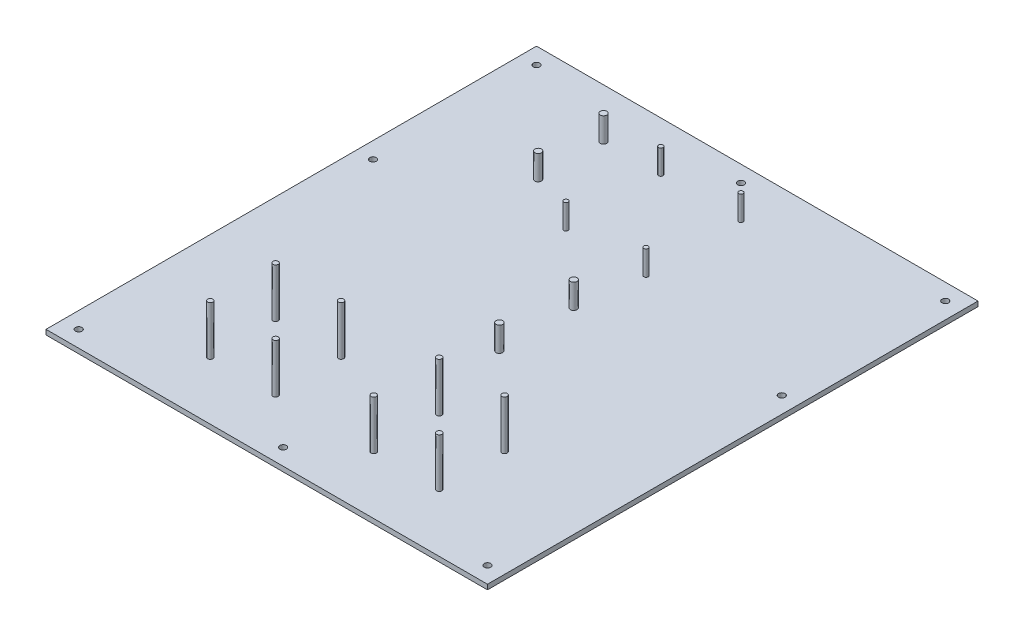
from build123d import *

# Parameters (mm, degrees)
SKETCH1_W            = 270
SKETCH1_H            = 300
SKETCH1_R            = 2
BOSS_EXTRUDE1_DEPTH  = 3
SKETCH2_R            = 1.35
BOSS_EXTRUDE2_DEPTH  = 10
SKETCH3_R            = 2
BOSS_EXTRUDE3_DEPTH  = 15
SKETCH4_R            = 1.35
BOSS_EXTRUDE4_DEPTH  = 5
SKETCH5_R            = 2
BOSS_EXTRUDE5_DEPTH  = 15
SKETCH6_R            = 1.6
BOSS_EXTRUDE6_DEPTH  = 15
SKETCH7_R            = 2
BOSS_EXTRUDE7_DEPTH  = 15
CUT_EXTRUDE1_START   = -15
SKETCH8_R            = 1.6
CUT_EXTRUDE1_DEPTH   = 15
SKETCH9_R            = 1.6
BOSS_EXTRUDE8_DEPTH  = 15
CUT_EXTRUDE3_START   = -15
SKETCH10_R           = 1.6
CUT_EXTRUDE3_DEPTH   = 15
SKETCH11_R           = 1.6
BOSS_EXTRUDE9_DEPTH  = 15
SKETCH12_R           = 1.6
BOSS_EXTRUDE10_DEPTH = 15
CUT_EXTRUDE4_START   = -15
SKETCH13_R           = 2
CUT_EXTRUDE4_DEPTH   = 15
SKETCH14_R           = 1.35
BOSS_EXTRUDE11_DEPTH = 15
CUT_EXTRUDE7_START   = -15
SKETCH15_R           = 1.35
CUT_EXTRUDE7_DEPTH   = 15
SKETCH16_R           = 1.35
BOSS_EXTRUDE12_DEPTH = 15
SKETCH18_R           = 1.35
CUT_EXTRUDE9_DEPTH   = 15


with BuildPart() as part:
    # Sketch1 → Boss-Extrude1 (new body)
    with BuildSketch(Plane(origin=(0, 0, 0), x_dir=(1, 0, 0), z_dir=(0, 1, 0))):
        with Locations((135, 150)):
            Rectangle(SKETCH1_W, SKETCH1_H)
        with Locations(Location((10, 290, 0), (0, 0, 270))):
            Circle(SKETCH1_R, mode=Mode.SUBTRACT)
        with Locations(Location((10, 190, 0), (0, 0, 270))):
            Circle(SKETCH1_R, mode=Mode.SUBTRACT)
        with Locations(Location((10, 10, 0), (0, 0, 270))):
            Circle(SKETCH1_R, mode=Mode.SUBTRACT)
        with Locations(Location((135, 10, 0), (0, 0, 270))):
            Circle(SKETCH1_R, mode=Mode.SUBTRACT)
        with Locations(Location((260, 290, 0), (0, 0, 90))):
            Circle(SKETCH1_R, mode=Mode.SUBTRACT)
        with Locations(Location((260, 190, 0), (0, 0, 90))):
            Circle(SKETCH1_R, mode=Mode.SUBTRACT)
        with Locations(Location((260, 10, 0), (0, 0, 90))):
            Circle(SKETCH1_R, mode=Mode.SUBTRACT)
        with Locations(Location((135, 290, 0), (0, 0, 270))):
            Circle(SKETCH1_R, mode=Mode.SUBTRACT)
    extrude(amount=BOSS_EXTRUDE1_DEPTH)

    # Sketch2 → Boss-Extrude2 (add)
    with BuildSketch(Plane(origin=(0, 3, 0), x_dir=(1, 0, 0), z_dir=(0, 1, 0))):
        with Locations(Location((106, 270, 0), (0, 0, 90))):
            Circle(SKETCH2_R)
        with Locations(Location((155, 270, 0), (0, 0, 90))):
            Circle(SKETCH2_R)
        with Locations(Location((106, 212, 0), (0, 0, 90))):
            Circle(SKETCH2_R)
        with Locations(Location((155, 212, 0), (0, 0, 90))):
            Circle(SKETCH2_R)
    extrude(amount=BOSS_EXTRUDE2_DEPTH)

    # Sketch3 → Boss-Extrude3 (add)
    with BuildSketch(Plane(origin=(0, 3, 0), x_dir=(1, 0, 0), z_dir=(0, 1, 0))):
        with Locations(Location((150, 172.75, 0), (0, 0, 90))):
            Circle(SKETCH3_R)
        with Locations(Location((150, 127.25, 0), (0, 0, 90))):
            Circle(SKETCH3_R)
    extrude(amount=BOSS_EXTRUDE3_DEPTH)

    # Sketch4 → Boss-Extrude4 (add)
    with BuildSketch(Plane(origin=(0, 13, 0), x_dir=(1, 0, 0), z_dir=(0, 1, 0))):
        with Locations(Location((106, 212, 0), (0, 0, 90))):
            Circle(SKETCH4_R)
        with Locations(Location((155, 212, 0), (0, 0, 90))):
            Circle(SKETCH4_R)
        with Locations(Location((155, 270, 0), (0, 0, 90))):
            Circle(SKETCH4_R)
        with Locations(Location((106, 270, 0), (0, 0, 90))):
            Circle(SKETCH4_R)
    extrude(amount=BOSS_EXTRUDE4_DEPTH)

    # Sketch5 → Boss-Extrude5 (add)
    with BuildSketch(Plane(origin=(0, 3, 0), x_dir=(1, 0, 0), z_dir=(0, 1, 0))):
        with Locations(Location((41, 270, 0), (0, 0, 90))):
            Circle(SKETCH5_R)
        with Locations(Location((71, 270, 0), (0, 0, 90))):
            Circle(SKETCH5_R)
    extrude(amount=BOSS_EXTRUDE5_DEPTH)

    # Sketch6 → Boss-Extrude6 (add)
    with BuildSketch(Plane(origin=(0, 3, 0), x_dir=(1, 0, 0), z_dir=(0, 1, 0))):
        with Locations(Location((65, 75.462075724, 0), (0, 0, 90))):
            Circle(SKETCH6_R)
        with Locations(Location((105, 75.462075724, 0), (0, 0, 90))):
            Circle(SKETCH6_R)
        with Locations(Location((65, 35.462075724, 0), (0, 0, 90))):
            Circle(SKETCH6_R)
        with Locations(Location((105, 35.462075724, 0), (0, 0, 90))):
            Circle(SKETCH6_R)
        with Locations(Location((165, 35.462075724, 0), (0, 0, 90))):
            Circle(SKETCH6_R)
        with Locations(Location((205, 35.462075724, 0), (0, 0, 90))):
            Circle(SKETCH6_R)
        with Locations(Location((205, 75.462075724, 0), (0, 0, 90))):
            Circle(SKETCH6_R)
        with Locations(Location((165, 75.462075724, 0), (0, 0, 90))):
            Circle(SKETCH6_R)
    extrude(amount=BOSS_EXTRUDE6_DEPTH)

    # Sketch7 → Boss-Extrude7 (add)
    with BuildSketch(Plane(origin=(0, 3, 0), x_dir=(1, 0, 0), z_dir=(0, 1, 0))):
        with Locations(Location((41, 230, 0), (0, 0, 90))):
            Circle(SKETCH7_R)
        with Locations(Location((71, 230, 0), (0, 0, 90))):
            Circle(SKETCH7_R)
    extrude(amount=BOSS_EXTRUDE7_DEPTH)

    # Sketch8 → Cut-Extrude1 (cut)
    with BuildSketch(Plane(origin=(0, 18, 0), x_dir=(1, 0, 0), z_dir=(0, 1, 0)).offset(CUT_EXTRUDE1_START)):
        with Locations((205, 75.462075724)):
            Circle(SKETCH8_R)
        with Locations((205, 35.462075724)):
            Circle(SKETCH8_R)
    extrude(amount=CUT_EXTRUDE1_DEPTH, mode=Mode.SUBTRACT)

    # Sketch9 → Boss-Extrude8 (add)
    with BuildSketch(Plane(origin=(0, 3, 0), x_dir=(1, 0, 0), z_dir=(0, 1, 0))):
        with Locations(Location((185, 75.462075724, 0), (0, 0, 90))):
            Circle(SKETCH9_R)
        with Locations(Location((185, 35.462075724, 0), (0, 0, 90))):
            Circle(SKETCH9_R)
    extrude(amount=BOSS_EXTRUDE8_DEPTH)

    # Sketch10 → Cut-Extrude3 (cut)
    with BuildSketch(Plane(origin=(0, 18, 0), x_dir=(1, 0, 0), z_dir=(0, 1, 0)).offset(CUT_EXTRUDE3_START)):
        with Locations((185, 75.462075724)):
            Circle(SKETCH10_R)
        with Locations((185, 35.462075724)):
            Circle(SKETCH10_R)
    extrude(amount=CUT_EXTRUDE3_DEPTH, mode=Mode.SUBTRACT)

    # Sketch11 → Boss-Extrude9 (add)
    with BuildSketch(Plane(origin=(0, 18, 0), x_dir=(1, 0, 0), z_dir=(0, 1, 0))):
        with Locations(Location((205, 75.462075724, 0), (0, 0, 270))):
            Circle(SKETCH11_R)
        with Locations(Location((205, 35.462075724, 0), (0, 0, 270))):
            Circle(SKETCH11_R)
    extrude(amount=-BOSS_EXTRUDE9_DEPTH)

    # Sketch12 → Boss-Extrude10 (add)
    with BuildSketch(Plane(origin=(0, 18, 0), x_dir=(1, 0, 0), z_dir=(0, 1, 0))):
        with Locations(Location((65, 35.462075724, 0), (0, 0, 90))):
            Circle(SKETCH12_R)
        with Locations(Location((105, 35.462075724, 0), (0, 0, 90))):
            Circle(SKETCH12_R)
        with Locations(Location((105, 75.462075724, 0), (0, 0, 90))):
            Circle(SKETCH12_R)
        with Locations(Location((65, 75.462075724, 0), (0, 0, 90))):
            Circle(SKETCH12_R)
        with Locations(Location((165, 75.462075724, 0), (0, 0, 90))):
            Circle(SKETCH12_R)
        with Locations(Location((165, 35.462075724, 0), (0, 0, 90))):
            Circle(SKETCH12_R)
        with Locations(Location((205, 35.462075724, 0), (0, 0, 270))):
            Circle(SKETCH12_R)
        with Locations(Location((205, 75.462075724, 0), (0, 0, 270))):
            Circle(SKETCH12_R)
    extrude(amount=BOSS_EXTRUDE10_DEPTH)

    # Sketch13 → Cut-Extrude4 (cut)
    with BuildSketch(Plane(origin=(0, 18, 0), x_dir=(1, 0, 0), z_dir=(0, 1, 0)).offset(CUT_EXTRUDE4_START)):
        with Locations((41, 270)):
            Circle(SKETCH13_R)
        with Locations((41, 230)):
            Circle(SKETCH13_R)
    extrude(amount=CUT_EXTRUDE4_DEPTH, mode=Mode.SUBTRACT)

    # Sketch14 → Boss-Extrude11 (add)
    with BuildSketch(Plane(origin=(0, 18, 0), x_dir=(1, 0, 0), z_dir=(0, 1, 0))):
        with Locations(Location((155, 190, 0), (0, 0, 270))):
            Circle(SKETCH14_R)
        with Locations(Location((106, 190, 0), (0, 0, 270))):
            Circle(SKETCH14_R)
        with Locations(Location((106, 248, 0), (0, 0, 270))):
            Circle(SKETCH14_R)
        with Locations(Location((155, 248, 0), (0, 0, 90))):
            Circle(SKETCH14_R)
    extrude(amount=-BOSS_EXTRUDE11_DEPTH)

    # Sketch15 → Cut-Extrude7 (cut)
    with BuildSketch(Plane(origin=(0, 18, 0), x_dir=(1, 0, 0), z_dir=(0, 1, 0)).offset(CUT_EXTRUDE7_START)):
        with Locations((106, 212)):
            Circle(SKETCH15_R)
        with Locations((155, 212)):
            Circle(SKETCH15_R)
        with Locations((155, 270)):
            Circle(SKETCH15_R)
        with Locations((106, 270)):
            Circle(SKETCH15_R)
    extrude(amount=CUT_EXTRUDE7_DEPTH, mode=Mode.SUBTRACT)

    # Sketch16 → Boss-Extrude12 (add)
    with BuildSketch(Plane(origin=(0, 18, 0), x_dir=(1, 0, 0), z_dir=(0, 1, 0))):
        with Locations(Location((106, 270, 0), (0, 0, 270))):
            Circle(SKETCH16_R)
        with Locations(Location((155, 270, 0), (0, 0, 270))):
            Circle(SKETCH16_R)
        with Locations(Location((106, 212, 0), (0, 0, 270))):
            Circle(SKETCH16_R)
        with Locations(Location((155, 212, 0), (0, 0, 270))):
            Circle(SKETCH16_R)
    extrude(amount=-BOSS_EXTRUDE12_DEPTH)

    # Sketch18 → Cut-Extrude9 (cut)
    with BuildSketch(Plane(origin=(0, 18, 0), x_dir=(1, 0, 0), z_dir=(0, 1, 0))):
        with Locations((106, 248)):
            Circle(SKETCH18_R)
        with Locations((155, 248)):
            Circle(SKETCH18_R)
        with Locations((155, 190)):
            Circle(SKETCH18_R)
        with Locations((106, 190)):
            Circle(SKETCH18_R)
    extrude(amount=-CUT_EXTRUDE9_DEPTH, mode=Mode.SUBTRACT)


solid = part.part
